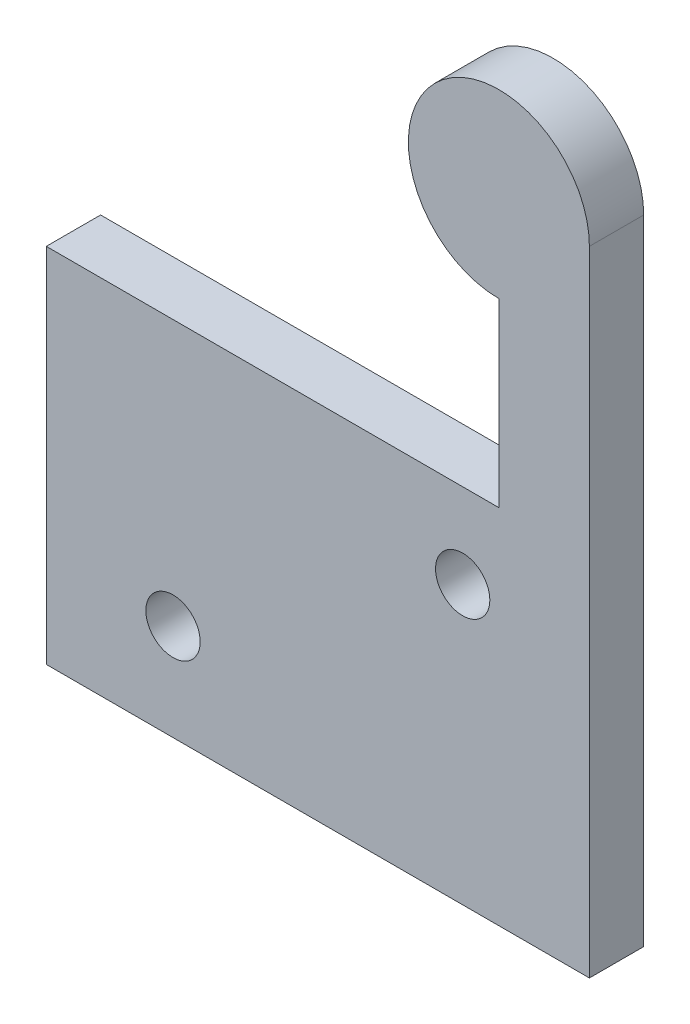
from build123d import *

# Parameters (mm, degrees)
EXTRUDE_1_DEPTH     = 3
SKETCH_2_R          = 1.5
CUT_EXTRUDE_2_DEPTH = 6


with BuildPart() as part:
    # 草图1 → 凸台-拉伸1 (new body)
    with BuildSketch(Plane.XY):
        with BuildLine():
            Line((14.91008261, 4.671258051), (14.91008261, 14.671258051))
            ThreePointArc((14.91008261, 14.671258051), (11.374548704, 23.206791957), (19.91008261, 19.671258051))
            Line((19.91008261, 19.671258051), (19.91008261, 7.339136796))
            Line((19.91008261, 7.339136796), (19.91008261, -15.328741949))
            Line((19.91008261, -15.328741949), (-10.08991739, -15.328741949))
            Line((-10.08991739, -15.328741949), (-10.08991739, 4.671258051))
            Line((-10.08991739, 4.671258051), (14.91008261, 4.671258051))
        make_face()
    extrude(amount=EXTRUDE_1_DEPTH)

    # 草图2 → 切除-拉伸2 (cut)
    with BuildSketch(Plane.XY.offset(3)):
        with Locations((12.91008261, 0)):
            Circle(SKETCH_2_R)
        with Locations((-3.08991739, -10)):
            Circle(SKETCH_2_R)
    extrude(amount=-CUT_EXTRUDE_2_DEPTH, mode=Mode.SUBTRACT)


solid = part.part
